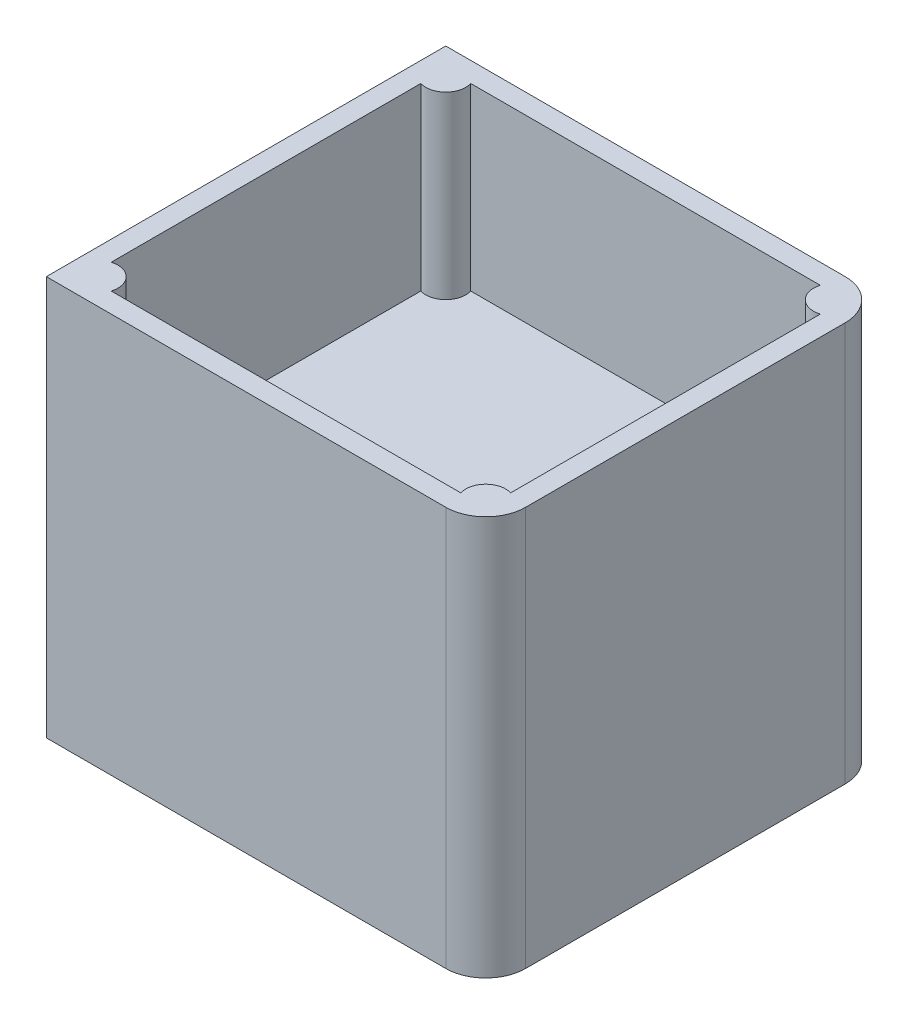
from build123d import *

# Parameters (mm, degrees)
BOSS_EXTRUDE1_DEPTH = 100
CUT_EXTRUDE1_DEPTH  = 50
CUT_EXTRUDE2_START  = -45
CUT_EXTRUDE2_DEPTH  = 45
SKETCH4_R           = 5
BOSS_EXTRUDE2_DEPTH = 45
SKETCH5_W           = 7.5
SKETCH5_H           = 5
CUT_EXTRUDE4_DEPTH  = 5


with BuildPart() as part:
    # Sketch1 → Boss-Extrude1 (new body)
    with BuildSketch(Plane(origin=(0, 0, 0), x_dir=(1, 0, 0), z_dir=(0, 1, 0))):
        with BuildLine():
            Line((-55, -50), (45, -50))
            ThreePointArc((45, -50), (52.071067812, -47.071067812), (55, -40))
            Line((55, -40), (55, 40))
            ThreePointArc((55, 40), (52.071067812, 47.071067812), (45, 50))
            Line((45, 50), (-55, 50))
            Line((-55, 50), (-55, -50))
        make_face()
    extrude(amount=BOSS_EXTRUDE1_DEPTH)

    # Sketch2 → Cut-Extrude1 (cut)
    with BuildSketch(Plane.XZ):
        with BuildLine():
            Line((-50, 45), (-50, -45))
            Line((-50, -45), (45, -45))
            ThreePointArc((45, -45), (48.535533906, -43.535533906), (50, -40))
            Line((50, -40), (50, 40))
            ThreePointArc((50, 40), (48.535533906, 43.535533906), (45, 45))
            Line((45, 45), (-50, 45))
        make_face()
    extrude(amount=-CUT_EXTRUDE1_DEPTH, mode=Mode.SUBTRACT)

    # Sketch3 → Cut-Extrude2 (cut)
    with BuildSketch(Plane(origin=(0, 100, 0), x_dir=(1, 0, 0), z_dir=(0, 1, 0)).offset(CUT_EXTRUDE2_START)):
        with BuildLine():
            Line((-50, 45), (-50, -45))
            Line((-50, -45), (45, -45))
            ThreePointArc((45, -45), (48.535533906, -43.535533906), (50, -40))
            Line((50, -40), (50, 40))
            ThreePointArc((50, 40), (48.535533906, 43.535533906), (45, 45))
            Line((45, 45), (-50, 45))
        make_face()
    extrude(amount=CUT_EXTRUDE2_DEPTH, mode=Mode.SUBTRACT)

    # Sketch4 → Boss-Extrude2 (add)
    with BuildSketch(Plane(origin=(0, 100, 0), x_dir=(1, 0, 0), z_dir=(0, 1, 0))):
        with Locations((48.535533906, -43.535533906)):
            Circle(SKETCH4_R)
        with Locations((48.535533906, 43.535533906)):
            Circle(SKETCH4_R)
        with Locations((-48.535533906, -43.535533906)):
            Circle(SKETCH4_R)
        with Locations((-48.535533906, 43.535533906)):
            Circle(SKETCH4_R)
    extrude(amount=-BOSS_EXTRUDE2_DEPTH)

    # Sketch5 → Cut-Extrude4 (cut)
    with BuildSketch(Plane.ZY.offset(55)):
        with Locations((0, 2.5)):
            Rectangle(SKETCH5_W, SKETCH5_H)
    extrude(amount=-CUT_EXTRUDE4_DEPTH, mode=Mode.SUBTRACT)


solid = part.part
